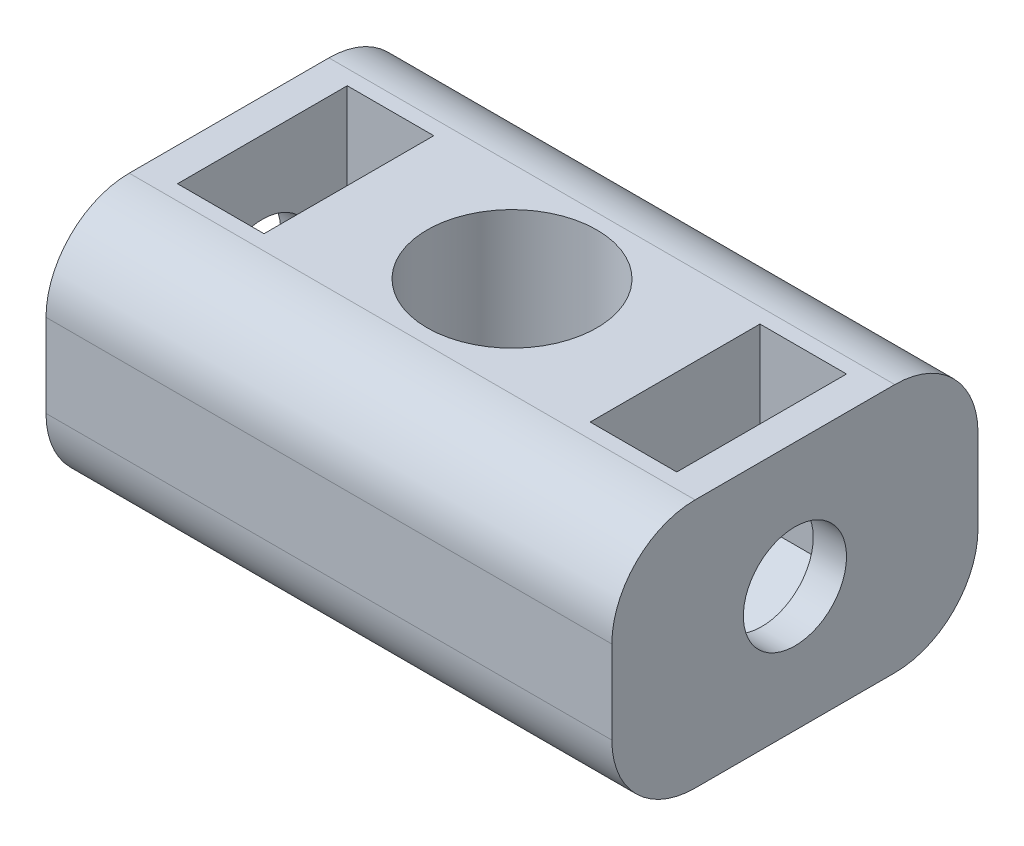
from build123d import *

# Parameters (mm, degrees)
CROQUIS1_W              = 34
CROQUIS1_H              = 22
CROQUIS1_R              = 5.1
SALIENTE_EXTRUIR1_DEPTH = 15
CORTAR_EXTRUIR1_DEPTH   = 5.2
CORTAR_EXTRUIR2_DEPTH   = 5.2
CROQUIS5_R              = 3.1
CORTAR_EXTRUIR4_DEPTH   = 4
CORTAR_EXTRUIR5_START   = -4
CROQUIS6_R              = 3.1
CORTAR_EXTRUIR5_DEPTH   = 4
REDONDEO1_R             = 5


with BuildPart() as part:
    # Croquis1 → Saliente-Extruir1 (new body)
    with BuildSketch(Plane(origin=(0, 0, 0), x_dir=(1, 0, 0), z_dir=(0, 1, 0))):
        with Locations((17, 11)):
            Rectangle(CROQUIS1_W, CROQUIS1_H)
        with Locations(Location((17, 11, 0), (0, 0, 270))):
            Circle(CROQUIS1_R, mode=Mode.SUBTRACT)
    extrude(amount=SALIENTE_EXTRUIR1_DEPTH)

    # Croquis2 → Cortar-Extruir1 (cut)
    with BuildSketch(Plane.ZY.offset(-2)):
        Polygon((-16.1, 10.444486373), (-16.1, 15), (-5.9, 15), (-5.9, 10.444486373), (-5.9, 4.555513627), (-11, 1.611027254), (-16.1, 4.555513627), align=None)
    extrude(amount=-CORTAR_EXTRUIR1_DEPTH, mode=Mode.SUBTRACT)

    # Croquis3 → Cortar-Extruir2 (cut)
    with BuildSketch(Plane(origin=(32, 0, 0), x_dir=(0, 0, -1), z_dir=(1, 0, 0))):
        Polygon((5.9, 15), (5.9, 4.555513627), (11, 1.611027254), (16.1, 4.555513627), (16.1, 15), align=None)
    extrude(amount=-CORTAR_EXTRUIR2_DEPTH, mode=Mode.SUBTRACT)

    # Croquis5 → Cortar-Extruir4 (cut)
    with BuildSketch(Plane(origin=(34, 0, 0), x_dir=(0, 0, -1), z_dir=(1, 0, 0))):
        with Locations((11, 7.5)):
            Circle(CROQUIS5_R)
    extrude(amount=-CORTAR_EXTRUIR4_DEPTH, mode=Mode.SUBTRACT)

    # Croquis6 → Cortar-Extruir5 (cut)
    with BuildSketch(Plane.ZY.offset(CORTAR_EXTRUIR5_START)):
        with Locations(Location((-11, 7.5, 0), (0, 0, 180))):
            Circle(CROQUIS6_R)
    extrude(amount=CORTAR_EXTRUIR5_DEPTH, mode=Mode.SUBTRACT)

    # Redondeo1
    redondeo1_edges = [part.edges().sort_by_distance(p)[0] for p in [
        (17, 15, -22),
        (17, 0, -22),
        (17, 0, 0),
        (17, 15, 0),
    ]]
    fillet(redondeo1_edges, radius=REDONDEO1_R)


solid = part.part
